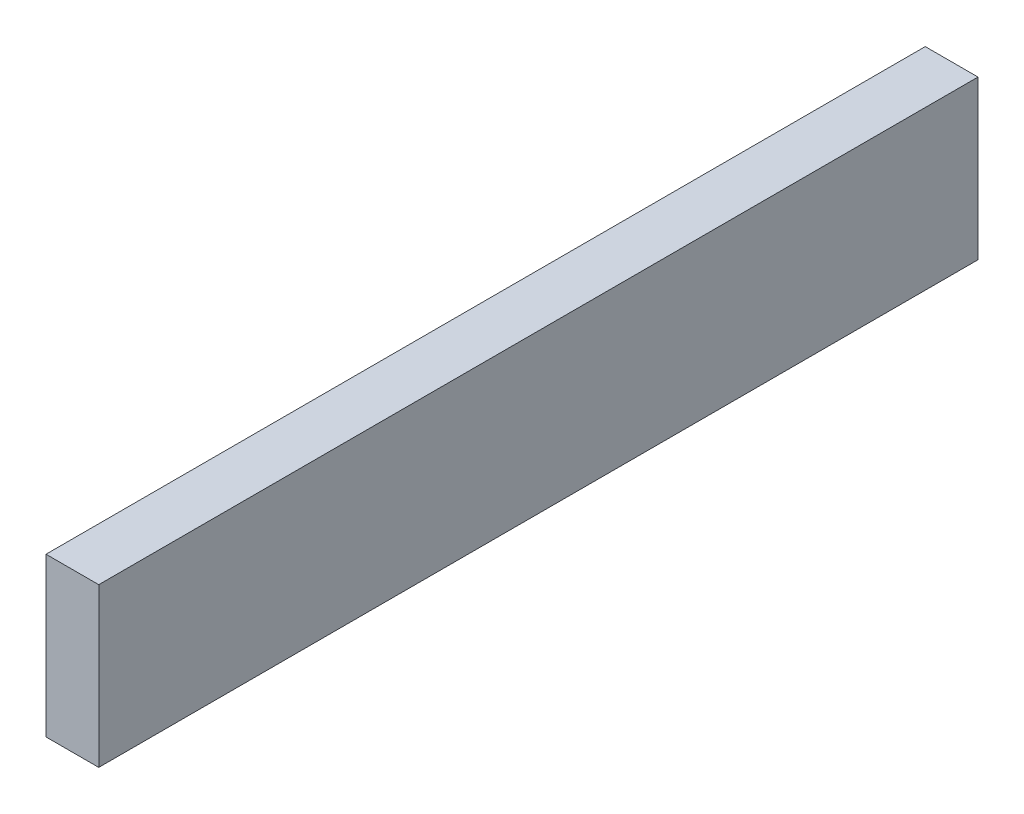
from build123d import *

# Parameters (mm, degrees)
SKETCH1_W           = 30
SKETCH1_H           = 90
BOSS_EXTRUDE1_DEPTH = 250


with BuildPart() as part:
    # Sketch1 → Boss-Extrude1 (new, symmetric)
    with BuildSketch(Plane.XY):
        Rectangle(SKETCH1_W, SKETCH1_H)
    extrude(amount=BOSS_EXTRUDE1_DEPTH, both=True)


solid = part.part
